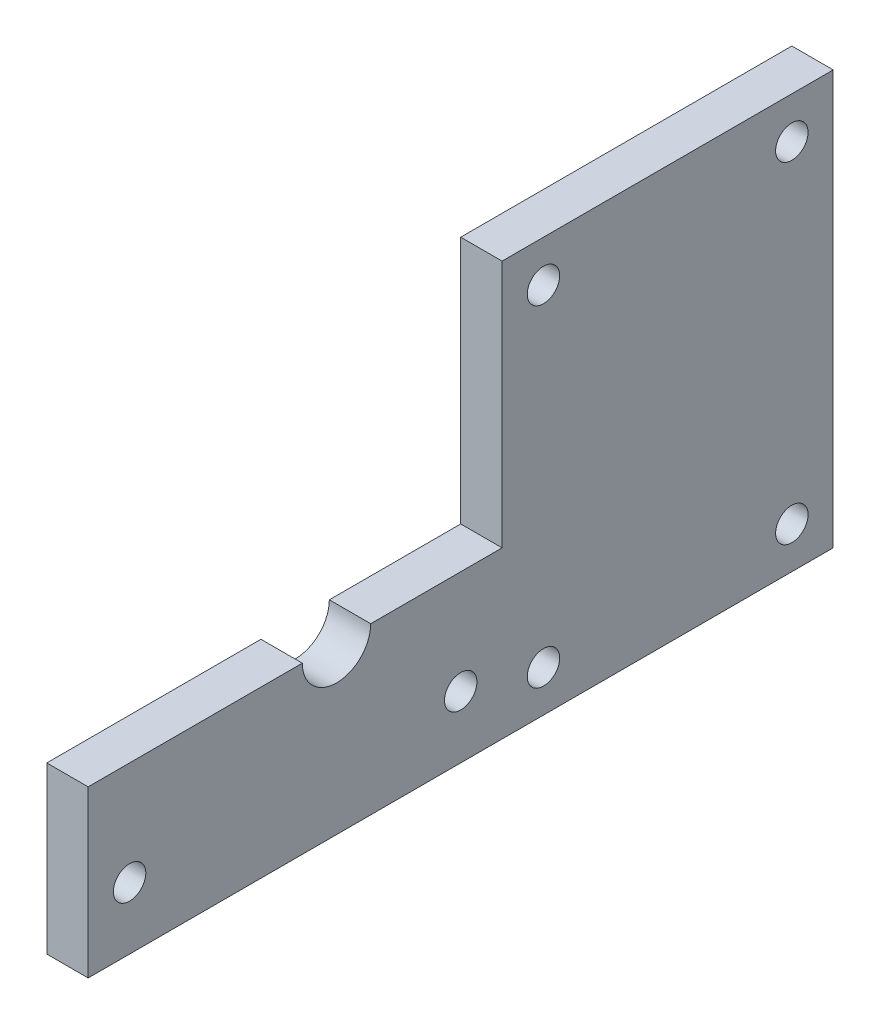
from build123d import *

# Parameters (mm, degrees)
BOSS_EXTRUDE1_DEPTH            = 6.35
F_9_0_196_DIAMETER_HOLE1_D     = 4.9784
F_9_0_196_DIAMETER_HOLE1_DEPTH = 70.104
F_9_0_196_DIAMETER_HOLE1_TIP   = 1.495662253
F_9_0_196_DIAMETER_HOLE2_D     = 4.9784
F_9_0_196_DIAMETER_HOLE2_DEPTH = 70.104
F_9_0_196_DIAMETER_HOLE2_TIP   = 1.495662253
Z_0_413_DIAMETER_HOLE1_D       = 10.4902
Z_0_413_DIAMETER_HOLE1_DEPTH   = 70.104
Z_0_413_DIAMETER_HOLE1_TIP     = 3.151574033


with BuildPart() as part:
    # Sketch1 → Boss-Extrude1 (new body)
    with BuildSketch(Plane(origin=(0, 0, 0), x_dir=(0, 0, -1), z_dir=(1, 0, 0))):
        Polygon((-50.8, -6.35), (12.7, -6.35), (12.7, 31.75), (63.5, 31.75), (63.5, -31.75), (-50.8, -31.75), align=None)
    extrude(amount=BOSS_EXTRUDE1_DEPTH)

    # #9 (0.196) Diameter Hole1
    with Locations(Plane.ZY):
        with Locations((44.45, -22.225), (-6.35, -22.225)):
            Hole(F_9_0_196_DIAMETER_HOLE1_D / 2, depth=F_9_0_196_DIAMETER_HOLE1_DEPTH)
            with Locations((0, 0, -(F_9_0_196_DIAMETER_HOLE1_DEPTH + F_9_0_196_DIAMETER_HOLE1_TIP / 2))):  # 118° drill point
                Cone(0, F_9_0_196_DIAMETER_HOLE1_D / 2, F_9_0_196_DIAMETER_HOLE1_TIP, mode=Mode.SUBTRACT)

    # #9 (0.196) Diameter Hole2
    with Locations(Plane.ZY):
        with Locations((-57.15, -25.4), (-19.05, -25.4), (-19.05, 25.4), (-57.15, 25.4)):
            Hole(F_9_0_196_DIAMETER_HOLE2_D / 2, depth=F_9_0_196_DIAMETER_HOLE2_DEPTH)
            with Locations((0, 0, -(F_9_0_196_DIAMETER_HOLE2_DEPTH + F_9_0_196_DIAMETER_HOLE2_TIP / 2))):  # 118° drill point
                Cone(0, F_9_0_196_DIAMETER_HOLE2_D / 2, F_9_0_196_DIAMETER_HOLE2_TIP, mode=Mode.SUBTRACT)

    # Z (0.413) Diameter Hole1
    with Locations(Plane.ZY):
        with Locations((12.7, -6.35)):
            Hole(Z_0_413_DIAMETER_HOLE1_D / 2, depth=Z_0_413_DIAMETER_HOLE1_DEPTH)
            with Locations((0, 0, -(Z_0_413_DIAMETER_HOLE1_DEPTH + Z_0_413_DIAMETER_HOLE1_TIP / 2))):  # 118° drill point
                Cone(0, Z_0_413_DIAMETER_HOLE1_D / 2, Z_0_413_DIAMETER_HOLE1_TIP, mode=Mode.SUBTRACT)


solid = part.part
